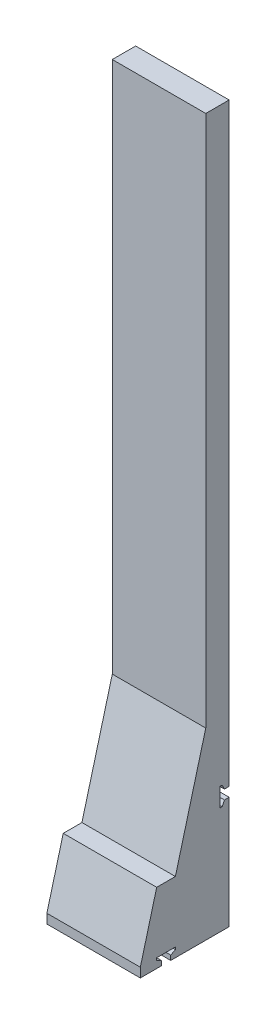
from build123d import *

# Parameters (mm, degrees)
EXTRUDE_1_DEPTH = 100


with BuildPart() as part:
    # 草图1 → 凸台-拉伸1 (new body)
    with BuildSketch(Plane(origin=(1150, 0, 0), x_dir=(0, 0, -1), z_dir=(1, 0, 0))):
        Polygon((-200, 50), (-200, 60), (-182.5, 125.310889132), (-162.5, 125.310889132), (-130, 246.602540378), (-130, 816.13921903), (-105, 816.13921903), (-105, 180), (-110, 180), (-112.5, 185), (-115, 185), (-115, 165), (-112.5, 165), (-110, 170), (-105, 170), (-105, 50), (-167.5, 50), (-167.5, 55), (-162.5, 57.5), (-162.5, 60), (-182.5, 60), (-182.5, 57.5), (-177.5, 55), (-177.5, 50), align=None)
    extrude(amount=EXTRUDE_1_DEPTH)


solid = part.part
